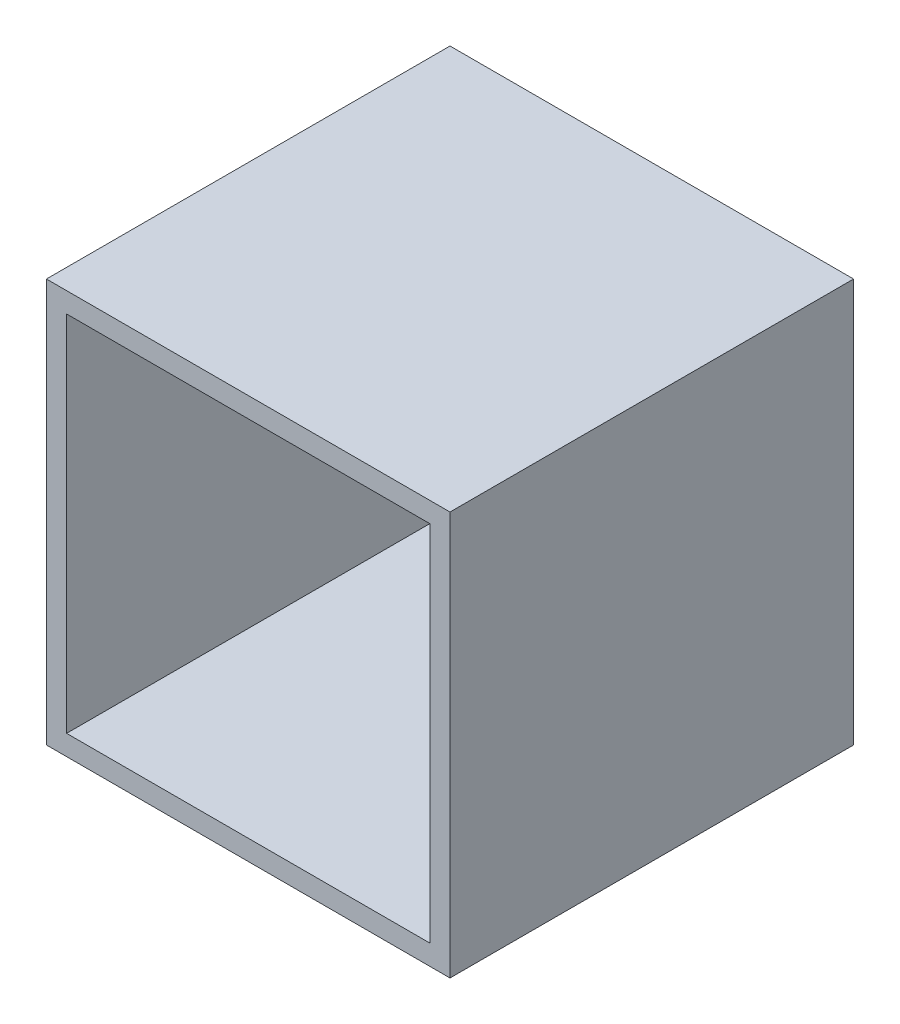
from build123d import *

# Parameters (mm, degrees)
SKETCH1_W           = 100
SKETCH1_H           = 100
BOSS_EXTRUDE1_DEPTH = 100
SHELL1_T            = -5


with BuildPart() as part:
    # Sketch1 → Boss-Extrude1 (new body)
    with BuildSketch(Plane.XY):
        with Locations((50, 50)):
            Rectangle(SKETCH1_W, SKETCH1_H)
    extrude(amount=BOSS_EXTRUDE1_DEPTH)

    # Shell1
    shell1_openings = [part.faces().sort_by_distance(p)[0] for p in [
        (50, 50, 100),
    ]]
    offset(amount=SHELL1_T, openings=shell1_openings, kind=Kind.INTERSECTION)


solid = part.part
